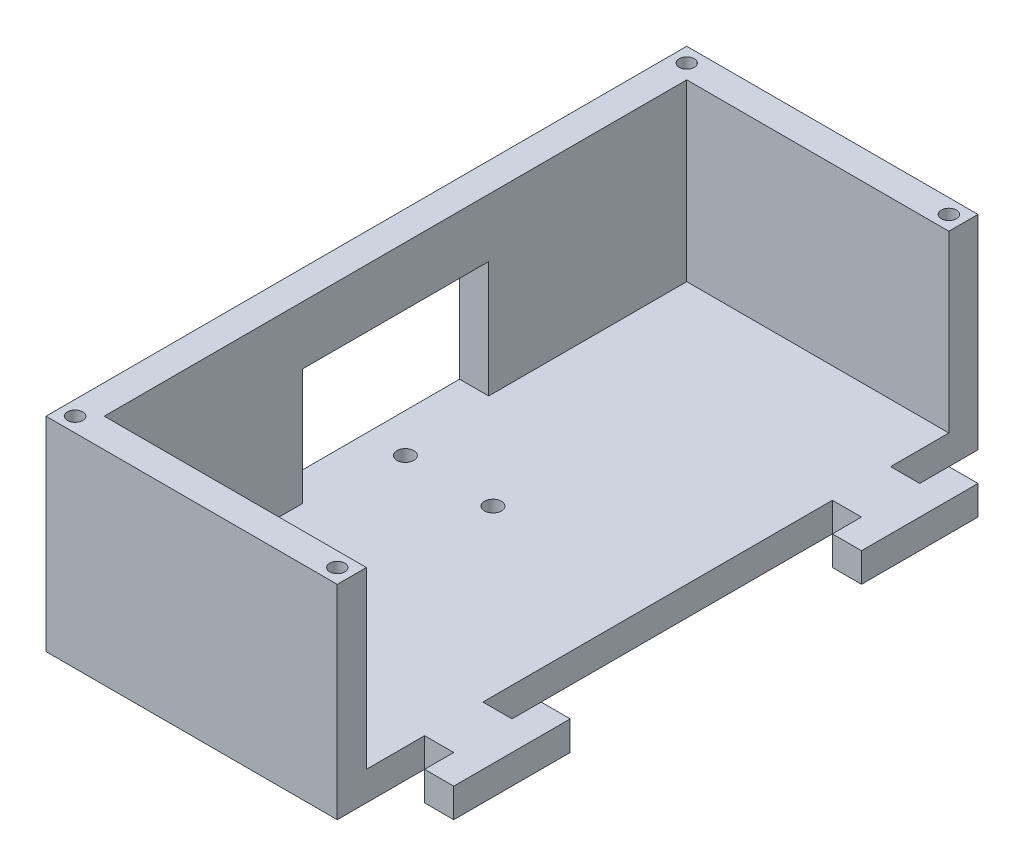
from build123d import *

# Parameters (mm, degrees)
SKETCH1_W                                  = 63.5
SKETCH1_H                                  = 139.7
BOSS_EXTRUDE1_DEPTH                        = 6.35
SKETCH3_W                                  = 63.5
SKETCH3_H                                  = 6.35
BOSS_EXTRUDE2_DEPTH                        = 38.1
BOSS_EXTRUDE3_DEPTH                        = 6.35
SKETCH7_R                                  = 1.85
CUT_EXTRUDE1_DEPTH                         = 92.139645599
SKETCH8_W                                  = 6.35
SKETCH8_H                                  = 43.18
BOSS_EXTRUDE4_DEPTH                        = 38.1
SKETCH9_W                                  = 40.64
SKETCH9_H                                  = 12.7
BOSS_EXTRUDE5_DEPTH                        = 6.35
SKETCH10_R                                 = 1.65
CUT_EXTRUDE2_DEPTH                         = 12
MIRROR2_AT_THE_SECOND_PLANE_COPY_1_SKETC_R = 1.65
MIRROR2_AT_THE_SECOND_PLANE_COPY_1_DEPTH   = 12


with BuildPart() as part:
    # Sketch1 → Boss-Extrude1 (new body)
    with BuildSketch(Plane(origin=(0, 0, 0), x_dir=(1, 0, 0), z_dir=(0, 1, 0))):
        with Locations((-6.35, 0)):
            Rectangle(SKETCH1_W, SKETCH1_H)
    extrude(amount=BOSS_EXTRUDE1_DEPTH)

    # Sketch3 → Boss-Extrude2 (add)
    with BuildSketch(Plane(origin=(0, 6.35, 0), x_dir=(1, 0, 0), z_dir=(0, 1, 0))):
        with Locations((-6.35, 66.675)):
            Rectangle(SKETCH3_W, SKETCH3_H)
        with Locations((-6.35, -66.675)):
            Rectangle(SKETCH3_W, SKETCH3_H)
    extrude(amount=BOSS_EXTRUDE2_DEPTH)

    # Sketch6 → Boss-Extrude3 (add)
    with BuildSketch(Plane(origin=(0, 6.35, 0), x_dir=(1, 0, 0), z_dir=(0, 1, 0))):
        Polygon((25.4, 50.8), (31.75, 50.8), (31.75, 57.15), (38.1, 57.15), (38.1, 31.75), (31.75, 31.75), (31.75, 38.1), (25.4, 38.1), align=None)
    boss_extrude3 = extrude(amount=-BOSS_EXTRUDE3_DEPTH)

    # Mirror1: Boss-Extrude3 across plane
    add(boss_extrude3.mirror(Plane.XY))

    # Sketch7 → Cut-Extrude1 (cut, through all)
    with BuildSketch(Plane.XZ):
        with Locations(Location((-10.5, 0, 0), (0, 0, 270))):
            Circle(SKETCH7_R)
        with Locations(Location((-29.6, 0, 0), (0, 0, 270))):
            Circle(SKETCH7_R)
    extrude(amount=-CUT_EXTRUDE1_DEPTH, mode=Mode.SUBTRACT)

    # Sketch8 → Boss-Extrude4 (add)
    with BuildSketch(Plane(origin=(0, 6.35, 0), x_dir=(1, 0, 0), z_dir=(0, 1, 0))):
        with Locations((-34.925, 41.91)):
            Rectangle(SKETCH8_W, SKETCH8_H)
        with Locations((-34.925, -41.91)):
            Rectangle(SKETCH8_W, SKETCH8_H)
    extrude(amount=BOSS_EXTRUDE4_DEPTH)

    # Sketch9 → Boss-Extrude5 (add)
    with BuildSketch(Plane.ZY.offset(38.1)):
        with Locations((0, 38.1)):
            Rectangle(SKETCH9_W, SKETCH9_H)
    extrude(amount=-BOSS_EXTRUDE5_DEPTH)

    # Sketch10 → Cut-Extrude2 (cut)
    with BuildSketch(Plane(origin=(0, 44.45, 0), x_dir=(1, 0, 0), z_dir=(0, 1, 0))):
        with Locations(Location((-34.925, 66.675, 0), (0, 0, 270))):
            Circle(SKETCH10_R)
    cut_extrude2 = extrude(amount=-CUT_EXTRUDE2_DEPTH, mode=Mode.SUBTRACT)

    # Mirror2: Cut-Extrude2 across plane
    add(cut_extrude2.mirror(Plane.ZY.offset(6.35)), mode=Mode.SUBTRACT)

    # Mirror2 at the second plane: Cut-Extrude2 across plane
    add(cut_extrude2.mirror(Plane.XY), mode=Mode.SUBTRACT)

    # Mirror2 at the second plane copy 1 sketc → Mirror2 at the second plane copy 1 (cut)
    with BuildSketch(Plane(origin=(-12.7, 44.45, 0), x_dir=(-1, 0, 0), z_dir=(0, 1, 0))):
        with Locations(Location((-34.925, 66.675, 0), (0, 0, 270))):
            Circle(MIRROR2_AT_THE_SECOND_PLANE_COPY_1_SKETC_R)
    extrude(amount=-MIRROR2_AT_THE_SECOND_PLANE_COPY_1_DEPTH, mode=Mode.SUBTRACT)


solid = part.part
